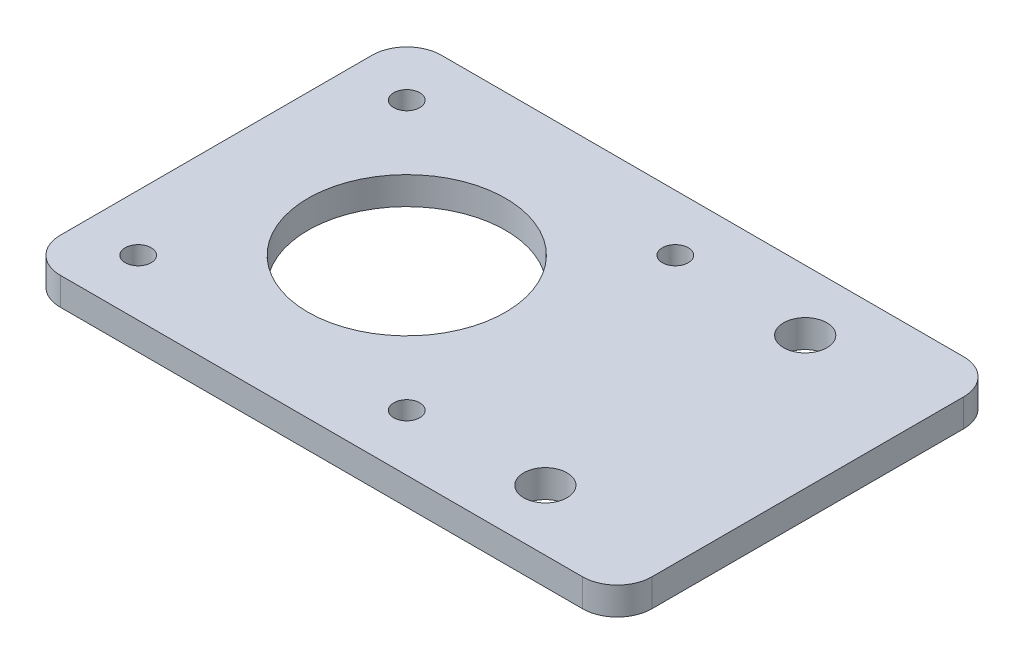
from build123d import *

# Parameters (mm, degrees)
SKETCH1_W           = 68.3
SKETCH1_H           = 44
BOSS_EXTRUDE1_DEPTH = 3.2
SKETCH2_R           = 11.4
SKETCH2_R_2         = 2.5
SKETCH2_R_3         = 1.5
CUT_EXTRUDE2_DEPTH  = 41.748772988
FILLET1_R           = 4


with BuildPart() as part:
    # Sketch1 → Boss-Extrude1 (new body)
    with BuildSketch(Plane(origin=(0, 0, 0), x_dir=(1, 0, 0), z_dir=(0, 1, 0))):
        Rectangle(SKETCH1_W, SKETCH1_H)
    extrude(amount=BOSS_EXTRUDE1_DEPTH)

    # Sketch2 → Cut-Extrude2 (cut, through all)
    with BuildSketch(Plane(origin=(0, 3.2, 0), x_dir=(1, 0, 0), z_dir=(0, 1, 0))):
        with Locations(Location((-12.15, 0, 0), (0, 0, 270))):
            Circle(SKETCH2_R)
        with Locations(Location((18.85, 15, 0), (0, 0, 270))):
            Circle(SKETCH2_R_2)
        with Locations(Location((18.85, -15, 0), (0, 0, 270))):
            Circle(SKETCH2_R_2)
        with Locations(Location((-27.65, 15.5, 0), (0, 0, 270))):
            Circle(SKETCH2_R_3)
        with Locations(Location((3.35, 15.5, 0), (0, 0, 270))):
            Circle(SKETCH2_R_3)
        with Locations(Location((3.35, -15.5, 0), (0, 0, 270))):
            Circle(SKETCH2_R_3)
        with Locations(Location((-27.65, -15.5, 0), (0, 0, 270))):
            Circle(SKETCH2_R_3)
    extrude(amount=-CUT_EXTRUDE2_DEPTH, mode=Mode.SUBTRACT)

    # Fillet1
    fillet1_edges = [part.edges().sort_by_distance(p)[0] for p in [
        (34.15, 1.6, 22),
        (-34.15, 1.6, 22),
        (-34.15, 1.6, -22),
        (34.15, 1.6, -22),
    ]]
    fillet(fillet1_edges, radius=FILLET1_R)


solid = part.part
